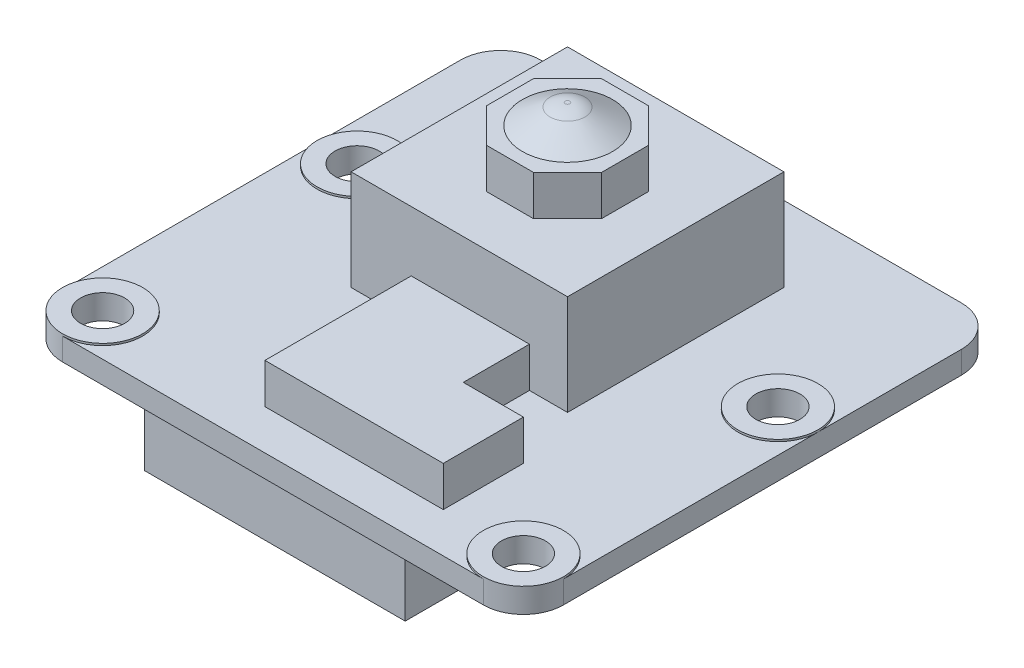
from build123d import *
from build123d.topology import SkipClean

# Parameters (mm, degrees)
SKETCH1_R           = 1.1
BOSS_EXTRUDE1_DEPTH = 1.12
SKETCH1_3_W         = 5.75
SKETCH1_3_H         = 5.75
BOSS_EXTRUDE2_DEPTH = 7
SKETCH1_4_W         = 5.75
SKETCH1_4_H         = 5.75
BOSS_EXTRUDE3_DEPTH = 5
BOSS_EXTRUDE4_DEPTH = 2
BOSS_EXTRUDE5_START = 0.1
SKETCH1_7_R         = 2
SKETCH1_7_R_2       = 1.1
BOSS_EXTRUDE5_DEPTH = 0.1
CHAMFER1_SIZE       = 1.7
SKETCH3_R           = 2.25
BOSS_EXTRUDE6_DEPTH = 1
BOSS_EXTRUDE6_TAPER = 60
FILLET1_R           = 1.5
SKETCH4_W           = 13
SKETCH4_H           = 4
BOSS_EXTRUDE7_DEPTH = 2.75


with BuildPart() as part:
    # Sketch1 → Boss-Extrude1 (new body)
    with BuildSketch(Plane(origin=(0, 0, 0), x_dir=(1, 0, 0), z_dir=(0, 1, 0))):
        with BuildLine():
            ThreePointArc((-12.5, -9.931), (-11.914214, -11.345214), (-10.5, -11.931))
            Line((-10.5, -11.931), (10.5, -11.931))
            ThreePointArc((10.5, -11.931), (11.914214, -11.345214), (12.5, -9.931))
            Line((12.5, -9.931), (12.5, 9.931))
            ThreePointArc((12.5, 9.931), (11.914214, 11.345214), (10.5, 11.931))
            Line((10.5, 11.931), (-10.5, 11.931))
            ThreePointArc((-10.5, 11.931), (-11.914214, 11.345214), (-12.5, 9.931))
            Line((-12.5, 9.931), (-12.5, -9.931))
        make_face()
        with Locations((-10.5, -9.931)):
            Circle(SKETCH1_R, mode=Mode.SUBTRACT)
        with Locations((10.5, -9.931)):
            Circle(SKETCH1_R, mode=Mode.SUBTRACT)
        with Locations((-10.5, 2.769)):
            Circle(SKETCH1_R, mode=Mode.SUBTRACT)
        with Locations((10.5, 2.769)):
            Circle(SKETCH1_R, mode=Mode.SUBTRACT)
    extrude(amount=-BOSS_EXTRUDE1_DEPTH)

    # Sketch1<3> → Boss-Extrude2 (add)
    with BuildSketch(Plane(origin=(0, 0, 0), x_dir=(1, 0, 0), z_dir=(0, 1, 0))):
        with Locations((0, 2.769)):
            Rectangle(SKETCH1_3_W, SKETCH1_3_H)
    extrude(amount=BOSS_EXTRUDE2_DEPTH)

    # Sketch1<4> → Boss-Extrude3 (add)
    with BuildSketch(Plane(origin=(0, 0, 0), x_dir=(1, 0, 0), z_dir=(0, 1, 0))):
        Polygon((-5.4, 8.169), (-5.4, -2.631), (-2.4, -2.631), (3.5, -2.631), (5.4, -2.631), (5.4, 8.169), align=None)
        with Locations((0, 2.769)):
            Rectangle(SKETCH1_4_W, SKETCH1_4_H, mode=Mode.SUBTRACT)
    extrude(amount=BOSS_EXTRUDE3_DEPTH)

    # Sketch1<6> → Boss-Extrude4 (add)
    with BuildSketch(Plane(origin=(0, 0, 0), x_dir=(1, 0, 0), z_dir=(0, 1, 0))):
        Polygon((3.5, -2.631), (-2.4, -2.631), (-2.4, -9.931), (6.5, -9.931), (6.5, -5.931), (3.5, -5.931), align=None)
    extrude(amount=BOSS_EXTRUDE4_DEPTH)

    # Sketch1<7> → Boss-Extrude5 (add)
    # profile 1 of 4: a face of its own
    with BuildSketch(Plane(origin=(0, 0, 0), x_dir=(1, 0, 0), z_dir=(0, 1, 0)).offset(BOSS_EXTRUDE5_START)):
        with Locations((10.5, 2.769)):
            Circle(SKETCH1_7_R)
        with Locations((10.5, 2.769)):
            Circle(SKETCH1_7_R_2, mode=Mode.SUBTRACT)
    # profile 2 of 4: a face of its own
    with BuildSketch(Plane(origin=(0, 0, 0), x_dir=(1, 0, 0), z_dir=(0, 1, 0)).offset(BOSS_EXTRUDE5_START)):
        with Locations((-10.5, 2.769)):
            Circle(SKETCH1_7_R)
        with Locations((-10.5, 2.769)):
            Circle(SKETCH1_7_R_2, mode=Mode.SUBTRACT)
    # profile 3 of 4: a face of its own
    with BuildSketch(Plane(origin=(0, 0, 0), x_dir=(1, 0, 0), z_dir=(0, 1, 0)).offset(BOSS_EXTRUDE5_START)):
        with Locations((-10.5, -9.931)):
            Circle(SKETCH1_7_R)
        with Locations((-10.5, -9.931)):
            Circle(SKETCH1_7_R_2, mode=Mode.SUBTRACT)
    # profile 4 of 4: a face of its own
    with BuildSketch(Plane(origin=(0, 0, 0), x_dir=(1, 0, 0), z_dir=(0, 1, 0)).offset(BOSS_EXTRUDE5_START)):
        with Locations((10.5, -9.931)):
            Circle(SKETCH1_7_R)
        with Locations((10.5, -9.931)):
            Circle(SKETCH1_7_R_2, mode=Mode.SUBTRACT)
    extrude(amount=-BOSS_EXTRUDE5_DEPTH)

    # Chamfer1
    chamfer1_edges = [part.edges().sort_by_distance(p)[0] for p in [
        (-2.875, 6, -5.644),
        (2.875, 6, -5.644),
        (2.875, 6, 0.106),
        (-2.875, 6, 0.106),
    ]]
    chamfer(chamfer1_edges, length=CHAMFER1_SIZE)

    # Sketch3 → Boss-Extrude6 (add)
    with SkipClean():  # the faces are left unmerged after this step: merging them gives an invalid solid
        with BuildSketch(Plane(origin=(0, 7, 0), x_dir=(1, 0, 0), z_dir=(0, 1, 0))):
            with Locations((0, 2.769)):
                Circle(SKETCH3_R)
        extrude(amount=BOSS_EXTRUDE6_DEPTH, taper=BOSS_EXTRUDE6_TAPER)

    # Fillet1
    fillet1_edges = [part.edges().sort_by_distance(p)[0] for p in [
        (-0.517949, 8, -2.769),
    ]]
    fillet(fillet1_edges, radius=FILLET1_R)

    # Sketch4 → Boss-Extrude7 (add)
    with SkipClean():  # the faces are left unmerged after this step: merging them gives an invalid solid
        with BuildSketch(Plane.XZ.offset(1.12)):
            with Locations((0, 9.831)):
                Rectangle(SKETCH4_W, SKETCH4_H)
        extrude(amount=BOSS_EXTRUDE7_DEPTH)


solid = part.part
